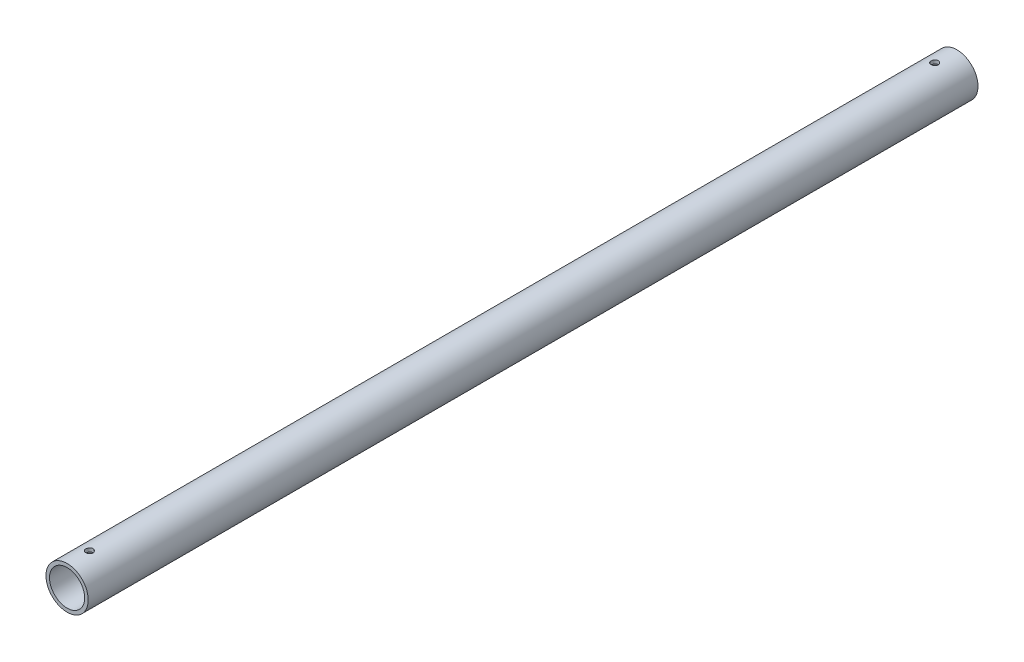
from build123d import *

# Parameters (mm, degrees)
SKETCH1_R               = 9.5
SKETCH1_R_2             = 7.9
BOSS_EXTRUDE1_DEPTH     = 400
CUT_EXTRUDE1_DEPTH      = 400
CUT_EXTRUDE1_DEPTH_BACK = 400
SKETCH2_R               = 1.6


with BuildPart() as part:
    # Sketch1 → Boss-Extrude1 (new body)
    with BuildSketch(Plane.XY):
        Circle(SKETCH1_R)
        Circle(SKETCH1_R_2, mode=Mode.SUBTRACT)
    extrude(amount=BOSS_EXTRUDE1_DEPTH)

    # Sketch2 → Cut-Extrude1 (cut, two sides: drawn at the far end of the back side and taken through both)
    with BuildSketch(Plane(origin=(0, 0, 0), x_dir=(1, 0, 0), z_dir=(0, 1, 0)).offset(-CUT_EXTRUDE1_DEPTH_BACK)):
        with Locations((0, -10)):
            Circle(SKETCH2_R)
        with Locations((0, -390)):
            Circle(SKETCH2_R)
    extrude(amount=CUT_EXTRUDE1_DEPTH + CUT_EXTRUDE1_DEPTH_BACK, mode=Mode.SUBTRACT)


solid = part.part
